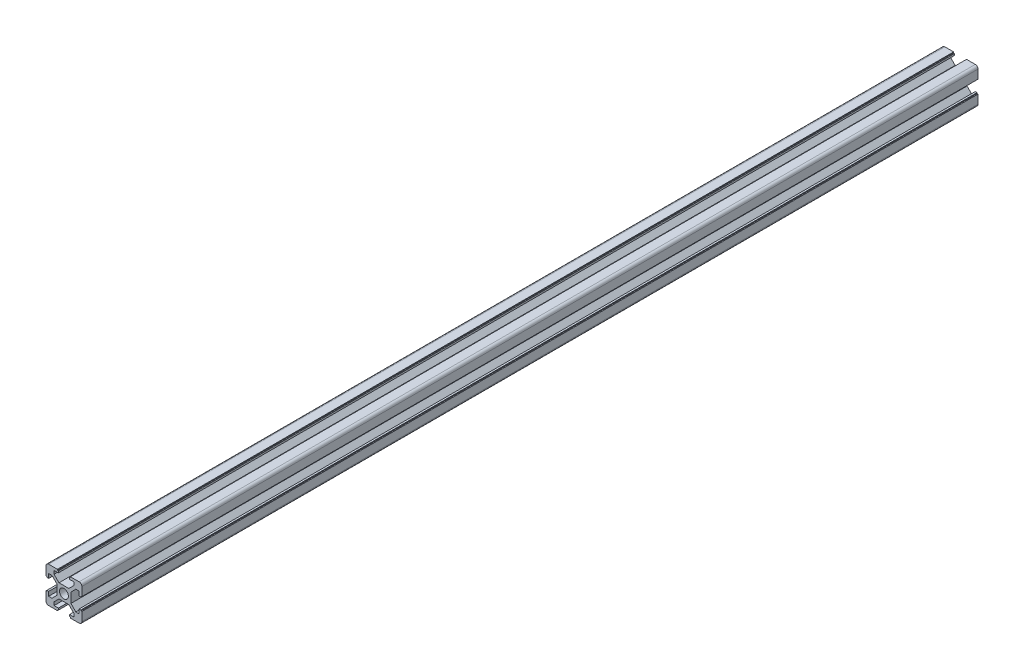
from build123d import *

# Parameters (mm, degrees)
SKETCH13_R               = 2.5
F_20_X_20_X_R1_5_1_DEPTH = 500


with BuildPart() as part:
    # Sketch13 → 铝型材 20 X 20 X R1.5(1) (new body)
    with BuildSketch(Plane.YX):
        with BuildLine():
            Line((-3.6, 10), (-3.6, 9.5))
            Line((-3.6, 9.5), (-3.1, 9.5))
            Line((-3.1, 9.5), (-3.1, 8.5))
            Line((-3.1, 8.5), (-5.5, 8.5))
            Line((-5.5, 8.5), (-5.5, 6.65))
            Line((-5.5, 6.65), (-2.75, 3.9))
            Line((-2.75, 3.9), (2.75, 3.9))
            Line((2.75, 3.9), (5.5, 6.65))
            Line((5.5, 6.65), (5.5, 8.5))
            Line((5.5, 8.5), (3.1, 8.5))
            Line((3.1, 8.5), (3.1, 9.5))
            Line((3.1, 9.5), (3.6, 9.5))
            Line((3.6, 9.5), (3.6, 10))
            Line((3.6, 10), (8.5, 10))
            ThreePointArc((8.5, 10), (9.560660172, 9.560660172), (10, 8.5))
            Line((10, 8.5), (10, 3.6))
            Line((10, 3.6), (9.5, 3.6))
            Line((9.5, 3.6), (9.5, 3.1))
            Line((9.5, 3.1), (8.5, 3.1))
            Line((8.5, 3.1), (8.5, 5.5))
            Line((8.5, 5.5), (6.65, 5.5))
            Line((6.65, 5.5), (3.9, 2.75))
            Line((3.9, 2.75), (3.9, -2.75))
            Line((3.9, -2.75), (6.65, -5.5))
            Line((6.65, -5.5), (8.5, -5.5))
            Line((8.5, -5.5), (8.5, -3.1))
            Line((8.5, -3.1), (9.5, -3.1))
            Line((9.5, -3.1), (9.5, -3.6))
            Line((9.5, -3.6), (10, -3.6))
            Line((10, -3.6), (10, -8.5))
            ThreePointArc((10, -8.5), (9.560660172, -9.560660172), (8.5, -10))
            Line((8.5, -10), (3.6, -10))
            Line((3.6, -10), (3.6, -9.5))
            Line((3.6, -9.5), (3.1, -9.5))
            Line((3.1, -9.5), (3.1, -8.5))
            Line((3.1, -8.5), (5.5, -8.5))
            Line((5.5, -8.5), (5.5, -6.65))
            Line((5.5, -6.65), (2.75, -3.9))
            Line((2.75, -3.9), (-2.75, -3.9))
            Line((-2.75, -3.9), (-5.5, -6.65))
            Line((-5.5, -6.65), (-5.5, -8.5))
            Line((-5.5, -8.5), (-3.1, -8.5))
            Line((-3.1, -8.5), (-3.1, -9.5))
            Line((-3.1, -9.5), (-3.6, -9.5))
            Line((-3.6, -9.5), (-3.6, -10))
            Line((-3.6, -10), (-8.5, -10))
            ThreePointArc((-8.5, -10), (-9.560660172, -9.560660172), (-10, -8.5))
            Line((-10, -8.5), (-10, -3.6))
            Line((-10, -3.6), (-9.5, -3.6))
            Line((-9.5, -3.6), (-9.5, -3.1))
            Line((-9.5, -3.1), (-8.5, -3.1))
            Line((-8.5, -3.1), (-8.5, -5.5))
            Line((-8.5, -5.5), (-6.65, -5.5))
            Line((-6.65, -5.5), (-3.9, -2.75))
            Line((-3.9, -2.75), (-3.9, 2.75))
            Line((-3.9, 2.75), (-6.65, 5.5))
            Line((-6.65, 5.5), (-8.5, 5.5))
            Line((-8.5, 5.5), (-8.5, 3.1))
            Line((-8.5, 3.1), (-9.5, 3.1))
            Line((-9.5, 3.1), (-9.5, 3.6))
            Line((-9.5, 3.6), (-10, 3.6))
            Line((-10, 3.6), (-10, 8.5))
            ThreePointArc((-10, 8.5), (-9.560660172, 9.560660172), (-8.5, 10))
            Line((-8.5, 10), (-3.6, 10))
        make_face()
        Circle(SKETCH13_R, mode=Mode.SUBTRACT)
    extrude(amount=F_20_X_20_X_R1_5_1_DEPTH)


solid = part.part
